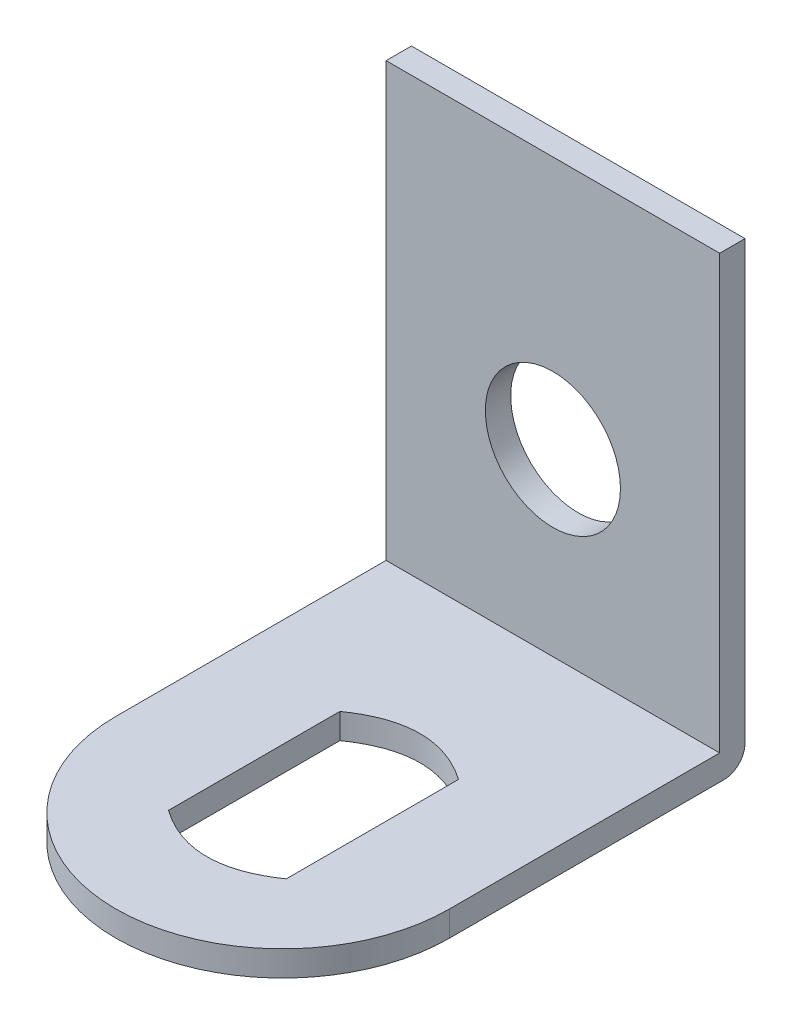
from build123d import *

# Parameters (mm, degrees)
BOSS_EXTRUDE1_DEPTH      = 7.9
BOSS_EXTRUDE1_DEPTH_BACK = 7.9
FILLET1_RADIUS           = 7.9
FILLET1_LENGTH           = 1.2
CUT_EXTRUDE3_DEPTH       = 32.020477108
SKETCH5_R                = 3.2
CUT_EXTRUDE4_DEPTH       = 32.01273941
FILLET3_R                = 1


with BuildPart() as part:
    # Sketch3 → Boss-Extrude1 (new, two sides: drawn at the far end of the back side and taken through both)
    with BuildSketch(Plane(origin=(0, 0, 0), x_dir=(0, 0, -1), z_dir=(1, 0, 0)).offset(-BOSS_EXTRUDE1_DEPTH_BACK)):
        Polygon((0, 0), (-21.9, 0), (-21.9, 1.2), (-1.2, 1.2), (-1.2, 21.7), (0, 21.7), align=None)
    extrude(amount=BOSS_EXTRUDE1_DEPTH + BOSS_EXTRUDE1_DEPTH_BACK)

    # Fillet1: full round fillet: the end face becomes a half cylinder, R = half its width
    fillet1_face = Plane((0, 0.6, 21.9), x_dir=(0, -1, 0), z_dir=(0, 0, 1))  # on the end face: x along it, z out of the body
    fillet1_slab = fillet1_face.offset(-FILLET1_RADIUS / 2) * Box(FILLET1_LENGTH, 2 * FILLET1_RADIUS, FILLET1_RADIUS, mode=Mode.PRIVATE)  # the body's end, R deep
    fillet1_round = Plane((0, 0.6, 14), x_dir=(0, 0, 1), z_dir=(0, -1, 0)) * Cylinder(FILLET1_RADIUS, FILLET1_LENGTH, mode=Mode.PRIVATE)  # its axis R under the face
    add(fillet1_slab - fillet1_round, mode=Mode.SUBTRACT)

    # Sketch4 → Cut-Extrude3 (cut, through all)
    with BuildSketch(Plane(origin=(0, 1.2, 0), x_dir=(1, 0, 0), z_dir=(0, 1, 0))):
        with BuildLine():
            Line((-2.8, -8.490258859), (-2.8, -16.609741141))
            add(Edge.make_bspline(
                [(2.8, -16.629870216), (-0.006277243, -18.580174221), (-2.8, -16.609741141)],
                knots=[0, 0, 0, 1, 1, 1], degree=2))
            Line((2.8, -16.629870216), (2.8, -8.470129784))
            add(Edge.make_bspline(
                [(2.8, -8.470129784), (-0.006277243, -6.519825779), (-2.8, -8.490258859)],
                knots=[0, 0, 0, 1, 1, 1], degree=2))
        make_face()
    extrude(amount=-CUT_EXTRUDE3_DEPTH, mode=Mode.SUBTRACT)

    # Sketch5 → Cut-Extrude4 (cut, through all)
    with BuildSketch(Plane.XY.offset(1.2)):
        with Locations((0, 9.7)):
            Circle(SKETCH5_R)
    extrude(amount=-CUT_EXTRUDE4_DEPTH, mode=Mode.SUBTRACT)

    # Fillet3
    fillet3_edges = [part.edges().sort_by_distance(p)[0] for p in [
        (0, 0, 0),
    ]]
    fillet(fillet3_edges, radius=FILLET3_R)


solid = part.part
